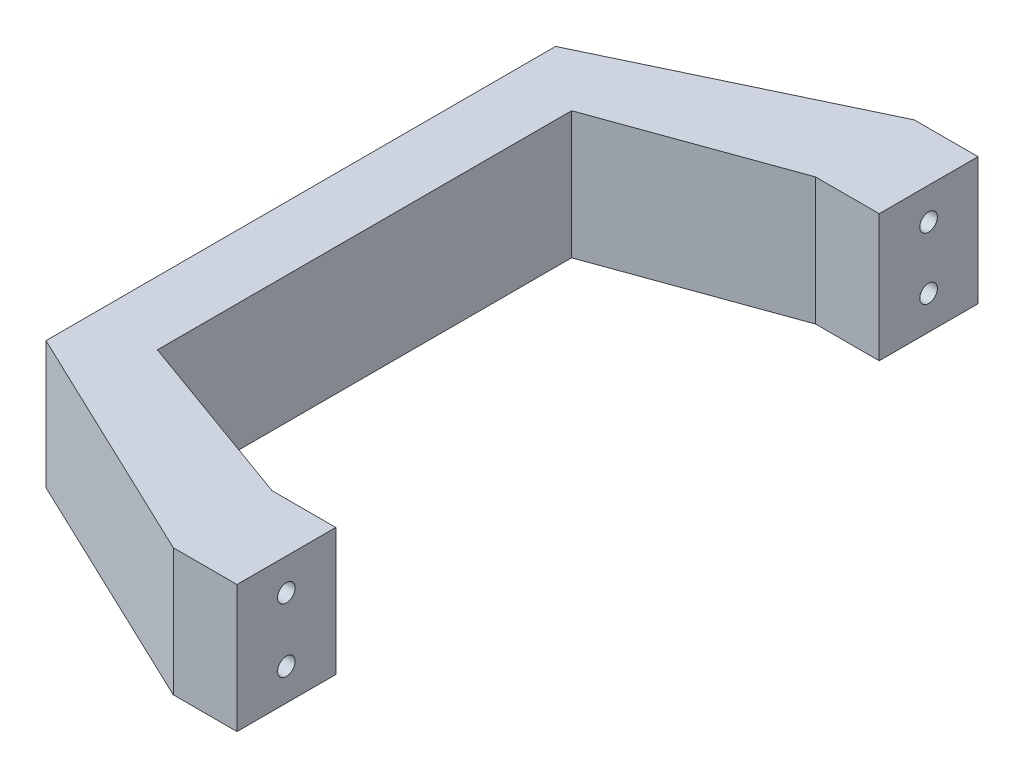
from build123d import *

# Parameters (mm, degrees)
BOSS_EXTRUDE1_DEPTH = 25.4
SKETCH2_R           = 1.7526
CUT_EXTRUDE1_DEPTH  = 12.7


with BuildPart() as part:
    # Sketch1 → Boss-Extrude1 (new body)
    with BuildSketch(Plane(origin=(0, 0, 0), x_dir=(1, 0, 0), z_dir=(0, 1, 0))):
        Polygon((-370.285159183, -60.760105329), (-370.285159183, -41.065192094), (-382.985159183, -41.065192094), (-431.431729332, -64.13440686), (-431.431729332, -165.73440686), (-382.985159183, -188.803621626), (-370.285159183, -188.803621626), (-370.285159183, -169.10870839), (-382.985159183, -169.10870839), (-418.731729332, -156.225276946), (-418.731729332, -73.643536773), (-382.985159183, -60.760105329), align=None)
    extrude(amount=BOSS_EXTRUDE1_DEPTH)

    # Sketch2 → Cut-Extrude1 (cut)
    with BuildSketch(Plane(origin=(-370.285159183, 0, 0), x_dir=(0, 0, -1), z_dir=(1, 0, 0))):
        with Locations((-178.956165008, 19.05)):
            Circle(SKETCH2_R)
        with Locations((-178.956165008, 6.35)):
            Circle(SKETCH2_R)
        with Locations((-50.912648711, 6.73055807)):
            Circle(SKETCH2_R)
        with Locations((-50.912648711, 19.05)):
            Circle(SKETCH2_R)
    extrude(amount=-CUT_EXTRUDE1_DEPTH, mode=Mode.SUBTRACT)


solid = part.part
